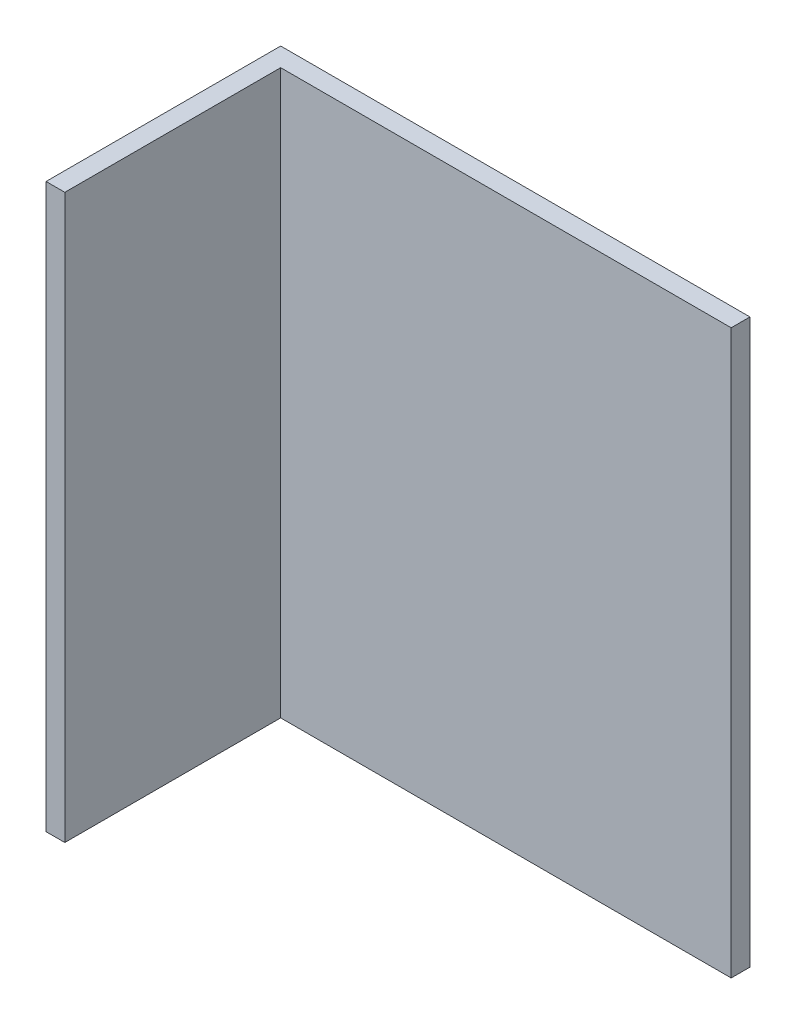
from build123d import *

# Parameters (mm, degrees)
SKETCH_1_W        = 200
SKETCH_1_H        = 240
EXTRUDE_303_DEPTH = 8
SKETCH_2_W        = 8
SKETCH_2_H        = 240
EXTRUDE_1_DEPTH   = 92


with BuildPart() as part:
    # 草图1 → Extrude 303 (new body)
    with BuildSketch(Plane.XY):
        with Locations((100, 120)):
            Rectangle(SKETCH_1_W, SKETCH_1_H)
    extrude(amount=EXTRUDE_303_DEPTH)

    # 草图2 → 凸台-拉伸1 (add)
    with BuildSketch(Plane.XY.offset(8)):
        with Locations((4, 120)):
            Rectangle(SKETCH_2_W, SKETCH_2_H)
    extrude(amount=EXTRUDE_1_DEPTH)


solid = part.part
